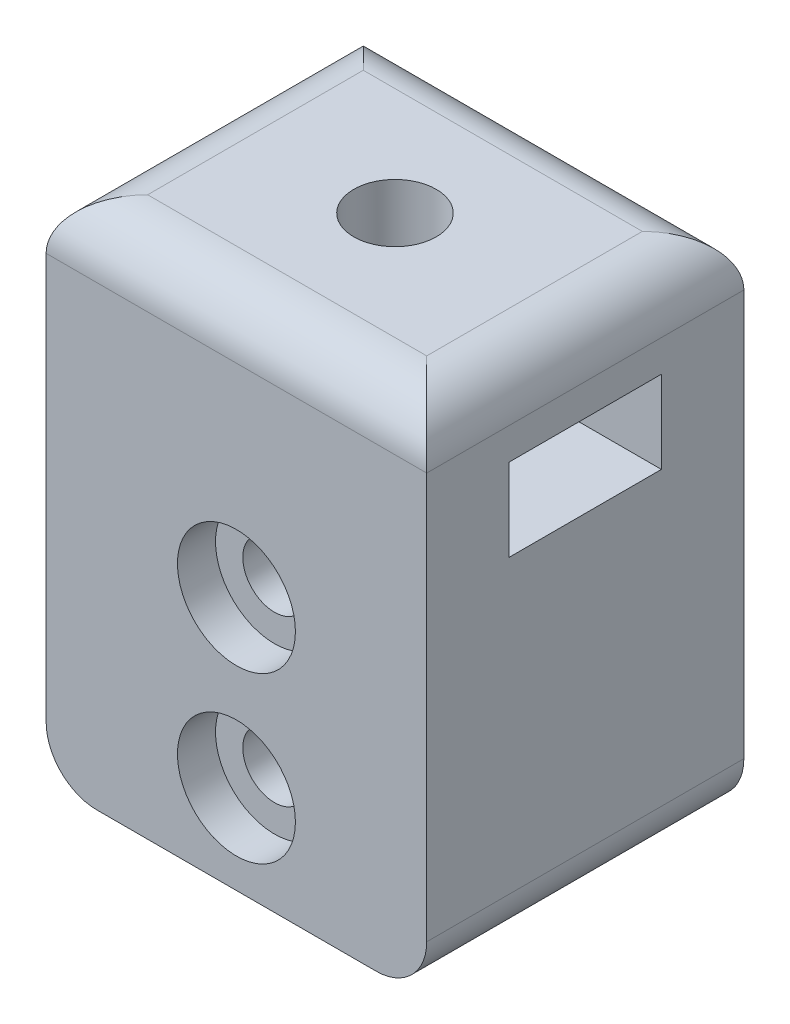
from build123d import *

# Parameters (mm, degrees)
CROQUIS1_W                 = 30
CROQUIS1_H                 = 25
SALIENTE_EXTRUIR1_DEPTH    = 20
CROQUIS2_W                 = 30
CROQUIS2_H                 = 25
SALIENTE_EXTRUIR2_DEPTH    = 20
CORTAR_EXTRUIR1_REACH      = 54.333
CROQUIS3_W                 = 12
CROQUIS3_H                 = 6.5
CROQUIS5_R                 = 3.5
CROQUIS5_W                 = 9.5
CROQUIS5_H                 = 3.5
CORTAR_EXTRUIR3_DEPTH      = 25
CROQUIS6_R                 = 4.65
CORTAR_EXTRUIR4_DEPTH      = 3
CORTAR_EXTRUIR5_REACH      = 52.354
CORTAR_EXTRUIR5_END_RADIUS = 3.5
CROQUIS7_R                 = 2.5
REDONDEO4_R                = 4
CROQUIS8_R                 = 3.25
CORTAR_EXTRUIR6_DEPTH      = 9.5
REDONDEO5_R                = 4


with BuildPart() as part:
    # Croquis1 → Saliente-Extruir1 (new body)
    with BuildSketch(Plane(origin=(0, 0, 0), x_dir=(1, 0, 0), z_dir=(0, 1, 0))):
        with Locations((6.25, -2.95)):
            Rectangle(CROQUIS1_W, CROQUIS1_H)
    extrude(amount=SALIENTE_EXTRUIR1_DEPTH)

    # Croquis2 → Saliente-Extruir2 (add)
    with BuildSketch(Plane(origin=(0, 20, 0), x_dir=(1, 0, 0), z_dir=(0, 1, 0))):
        with Locations((6.25, -2.95)):
            Rectangle(CROQUIS2_W, CROQUIS2_H)
    extrude(amount=SALIENTE_EXTRUIR2_DEPTH)

    # Croquis3 → Cortar-Extruir1 (cut, up to next)
    with BuildSketch(Plane.ZY.offset(8.75), mode=Mode.PRIVATE) as cortar_extruir1_sk1:
        with Locations((2.95, 30.25)):
            Rectangle(CROQUIS3_W, CROQUIS3_H)
    cortar_extruir1_tool1 = extrude(cortar_extruir1_sk1.sketch, amount=-CORTAR_EXTRUIR1_REACH, mode=Mode.PRIVATE) & part.part
    add(cortar_extruir1_tool1.solids().sort_by_distance((-8.75, 30.25, 2.95))[0], mode=Mode.SUBTRACT)

    # Croquis5 → Cortar-Extruir3 (cut)
    with BuildSketch(Plane.XZ):
        with Locations(Location((6.25, 0.45, 0), (0, 0, 270))):
            Circle(CROQUIS5_R)
        with Locations((6.25, 6.7)):
            Rectangle(CROQUIS5_W, CROQUIS5_H)
    extrude(amount=-CORTAR_EXTRUIR3_DEPTH, mode=Mode.SUBTRACT)

    # Croquis6 → Cortar-Extruir4 (cut)
    with BuildSketch(Plane.XY.offset(15.45)):
        with Locations((6.25, 7)):
            Circle(CROQUIS6_R)
        with Locations((6.25, 20)):
            Circle(CROQUIS6_R)
    extrude(amount=-CORTAR_EXTRUIR4_DEPTH, mode=Mode.SUBTRACT)

    # Cortar-Extruir5: up to this cylinder (the profile starts outside it)
    cortar_extruir5_end = Plane(origin=(6.25, 13.5, 0.45), z_dir=(0, -1, 0)) * Cylinder(CORTAR_EXTRUIR5_END_RADIUS, 125.708, mode=Mode.PRIVATE)
    # Croquis7 → Cortar-Extruir5 (cut, up to the surface)
    with BuildSketch(Plane.XY.offset(12.45), mode=Mode.PRIVATE) as cortar_extruir5_sk1:
        with Locations((6.25, 20)):
            Circle(CROQUIS7_R)
    cortar_extruir5_tool1 = extrude(cortar_extruir5_sk1.sketch, amount=-CORTAR_EXTRUIR5_REACH, mode=Mode.PRIVATE) - cortar_extruir5_end
    add(cortar_extruir5_tool1.solids().sort_by_distance((6.25, 20, 12.45))[0], mode=Mode.SUBTRACT)
    # Croquis7 → Cortar-Extruir5 (cut, up to the surface)
    with BuildSketch(Plane.XY.offset(12.45), mode=Mode.PRIVATE) as cortar_extruir5_sk2:
        with Locations((6.25, 7)):
            Circle(CROQUIS7_R)
    cortar_extruir5_tool2 = extrude(cortar_extruir5_sk2.sketch, amount=-CORTAR_EXTRUIR5_REACH, mode=Mode.PRIVATE) - cortar_extruir5_end
    add(cortar_extruir5_tool2.solids().sort_by_distance((6.25, 7, 12.45))[0], mode=Mode.SUBTRACT)

    # Redondeo4
    redondeo4_edges = [part.edges().sort_by_distance(p)[0] for p in [
        (21.25, 0, 2.95),
        (-8.75, 0, 2.95),
    ]]
    fillet(redondeo4_edges, radius=REDONDEO4_R)

    # Croquis8 → Cortar-Extruir6 (cut, symmetric)
    with BuildSketch(Plane.XZ.offset(-33.5)):
        with Locations(Location((6.25, 2.95, 0), (0, 0, 270))):
            Circle(CROQUIS8_R)
    extrude(amount=CORTAR_EXTRUIR6_DEPTH, both=True, mode=Mode.SUBTRACT)

    # Redondeo5
    redondeo5_edges = [part.edges().sort_by_distance(p)[0] for p in [
        (6.25, 40, 15.45),
        (21.25, 40, 2.95),
        (6.25, 40, -9.55),
        (-8.75, 40, 2.95),
    ]]
    fillet(redondeo5_edges, radius=REDONDEO5_R)


solid = part.part
